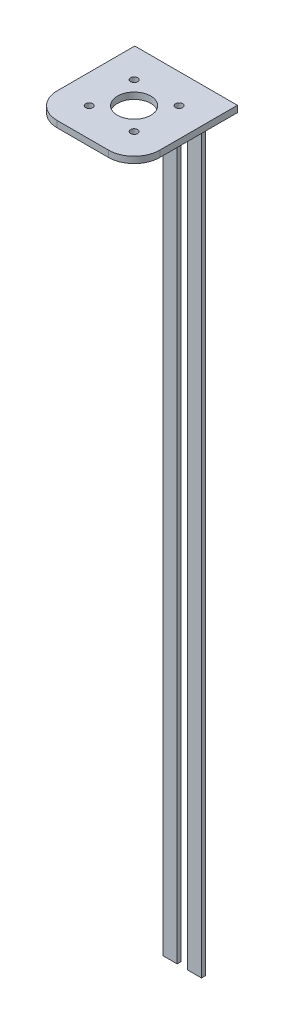
from build123d import *

# Parameters (mm, degrees)
SKETCH1_R           = 13
SKETCH1_R_2         = 2.75
BOSS_EXTRUDE1_DEPTH = 5
SKETCH2_W           = 11
SKETCH2_H           = 600
BOSS_EXTRUDE2_DEPTH = 3
FILLET1_R           = 20


with BuildPart() as part:
    # Sketch1 → Boss-Extrude1 (new body)
    with BuildSketch(Plane(origin=(0, 0, 0), x_dir=(1, 0, 0), z_dir=(0, 1, 0))):
        Polygon((40, -40), (-40, -40), (-40, 40), (-40, 40.5), (40, 40.5), (40, 40), align=None)
        Circle(SKETCH1_R, mode=Mode.SUBTRACT)
        with Locations((-17.5, -17.5)):
            Circle(SKETCH1_R_2, mode=Mode.SUBTRACT)
        with Locations((17.5, -17.5)):
            Circle(SKETCH1_R_2, mode=Mode.SUBTRACT)
        with Locations((17.5, 17.5)):
            Circle(SKETCH1_R_2, mode=Mode.SUBTRACT)
        with Locations((-17.5, 17.5)):
            Circle(SKETCH1_R_2, mode=Mode.SUBTRACT)
    extrude(amount=BOSS_EXTRUDE1_DEPTH)

    # Sketch2 → Boss-Extrude2 (add)
    with BuildSketch(Plane(origin=(0, 0, -40.5), x_dir=(-1, 0, 0), z_dir=(0, 0, -1))):
        with Locations((9.5, -295)):
            Rectangle(SKETCH2_W, SKETCH2_H)
        with Locations((-9.5, -295)):
            Rectangle(SKETCH2_W, SKETCH2_H)
    extrude(amount=-BOSS_EXTRUDE2_DEPTH)

    # Fillet1
    fillet1_edges = [part.edges().sort_by_distance(p)[0] for p in [
        (40, 2.5, 40),
        (-40, 2.5, 40),
    ]]
    fillet(fillet1_edges, radius=FILLET1_R)


solid = part.part
